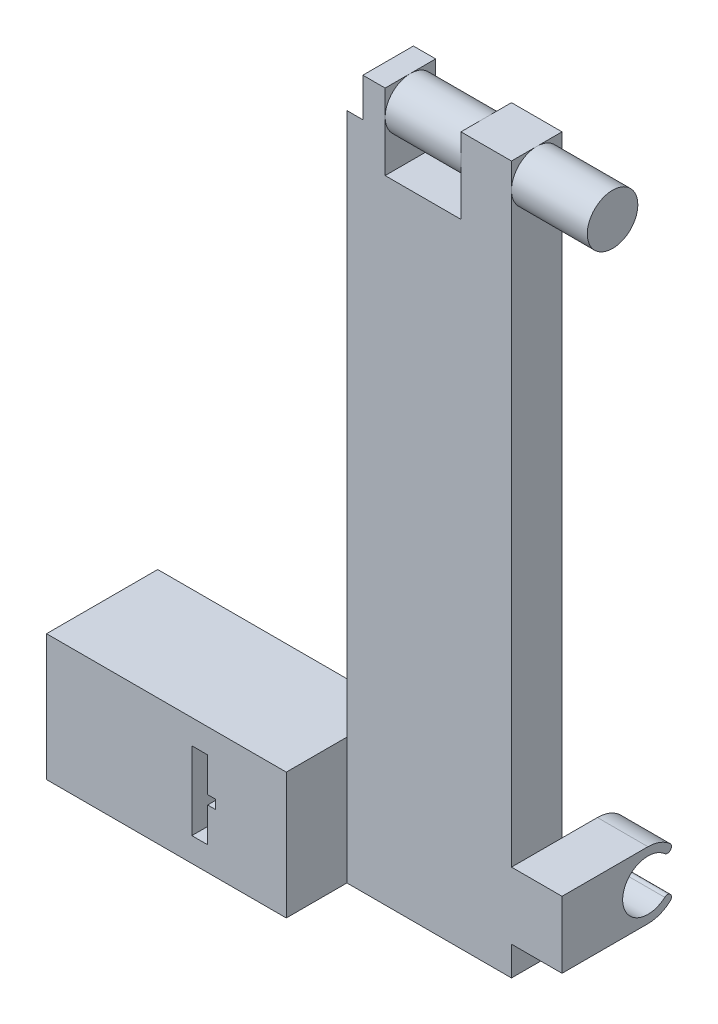
from build123d import *

# Parameters (mm, degrees)
SKETCH1_W           = 12.7
SKETCH1_H           = 12.7
BOSS_EXTRUDE1_DEPTH = 177.8
SKETCH2_R           = 6.35
BOSS_EXTRUDE2_DEPTH = 25.4
SKETCH3_W           = 12.7
SKETCH3_H           = 158.75
BOSS_EXTRUDE3_DEPTH = 28.652
BOSS_EXTRUDE4_START = 19.05
SKETCH4_W           = 12.7
SKETCH4_H           = 19.05
BOSS_EXTRUDE4_DEPTH = 9.602
CUT_EXTRUDE1_START  = -4
SKETCH5_R           = 1.274448637
CUT_EXTRUDE1_DEPTH  = 4
CUT_EXTRUDE2_START  = -6.35
SKETCH5_2_R         = 1.274448637
CUT_EXTRUDE2_DEPTH  = 6.35
SKETCH8_W           = 9.448
SKETCH8_H           = 31.75
SKETCH8_W_2         = 50.8
BOSS_EXTRUDE5_DEPTH = 12.7
SKETCH8_3_W         = 9.448
SKETCH8_3_H         = 31.75
SKETCH8_3_W_2       = 50.8
BOSS_EXTRUDE6_DEPTH = 15.24
SKETCH9_W           = 41.402
SKETCH9_H           = 20.066
CUT_EXTRUDE3_DEPTH  = 21.082
SKETCH7_W           = 12.7
SKETCH7_H           = 16.764
BOSS_EXTRUDE7_DEPTH = 12.7
BOSS_EXTRUDE8_START = -38.1
BOSS_EXTRUDE8_DEPTH = 12.7
SKETCH10_W          = 3.962
SKETCH10_H          = 19.562
SKETCH10_W_2        = 3.2
SKETCH10_H_2        = 18.8
SKETCH10_W_3        = 2.372565257
SKETCH10_H_3        = 2.262
CUT_EXTRUDE4_DEPTH  = 207.185481547


with BuildPart() as part:
    # Sketch1 → Boss-Extrude1 (new body)
    with BuildSketch(Plane(origin=(0, 0, 0), x_dir=(1, 0, 0), z_dir=(0, 1, 0))):
        Rectangle(SKETCH1_W, SKETCH1_H)
    extrude(amount=-BOSS_EXTRUDE1_DEPTH)

    # Sketch2 → Boss-Extrude2 (add, symmetric)
    with BuildSketch(Plane(origin=(0, 0, 0), x_dir=(0, 0, -1), z_dir=(1, 0, 0))):
        with Locations((0, -6.35)):
            Circle(SKETCH2_R)
    extrude(amount=BOSS_EXTRUDE2_DEPTH, both=True)

    # Sketch3 → Boss-Extrude3 (add)
    with BuildSketch(Plane.ZY.offset(6.35)):
        with Locations((0, -98.425)):
            Rectangle(SKETCH3_W, SKETCH3_H)
    extrude(amount=BOSS_EXTRUDE3_DEPTH)

    # Sketch4 → Boss-Extrude4 (add)
    with BuildSketch(Plane.ZY.offset(6.35).offset(BOSS_EXTRUDE4_START)):
        with Locations((0, -9.525)):
            Rectangle(SKETCH4_W, SKETCH4_H)
    extrude(amount=BOSS_EXTRUDE4_DEPTH)

    # Sketch5 → Cut-Extrude1 (cut)
    with BuildSketch(Plane.ZY.offset(35.002).offset(CUT_EXTRUDE1_START)):
        with BuildLine():
            Line((-3.833, -30.756), (-3.833, -16.606))
            ThreePointArc((-3.833, -16.606), (-4.34616702, -13.44372234), (-5.833, -10.606))
            ThreePointArc((-5.833, -10.606), (-6.104434225, -10.218346078), (-6.35, -9.81380986))
            Line((-6.35, -9.81380986), (-6.35, 0))
            Line((-6.35, 0), (-3.697009279, 0))
            Line((-3.697009279, 0), (3.631009279, 0))
            Line((3.631009279, 0), (6.35, 0))
            Line((6.35, 0), (6.35, -9.693995201))
            ThreePointArc((6.35, -9.693995201), (6.075544052, -10.160893028), (5.767, -10.606))
            ThreePointArc((5.767, -10.606), (4.280167019, -13.44372234), (3.767, -16.606))
            Line((3.767, -16.606), (3.767, -30.756))
            ThreePointArc((3.767, -30.756), (-0.033, -34.556), (-3.833, -30.756))
        make_face()
        with Locations(Location((-0.033, -26.756, 0), (0, 0, 270))):
            Circle(SKETCH5_R, mode=Mode.SUBTRACT)
        with Locations(Location((-0.033, -30.756, 0), (0, 0, 270))):
            Circle(SKETCH5_R, mode=Mode.SUBTRACT)
    extrude(amount=CUT_EXTRUDE1_DEPTH, mode=Mode.SUBTRACT)

    # Sketch5<2> → Cut-Extrude2 (cut)
    with BuildSketch(Plane.ZY.offset(35.002).offset(CUT_EXTRUDE2_START)):
        with Locations(Location((-0.033, -26.756, 0), (0, 0, 270))):
            Circle(SKETCH5_2_R)
        with Locations(Location((-0.033, -30.756, 0), (0, 0, 270))):
            Circle(SKETCH5_2_R)
    extrude(amount=CUT_EXTRUDE2_DEPTH, mode=Mode.SUBTRACT)

    # Sketch8 → Boss-Extrude5 (add)
    with BuildSketch(Plane.XY.offset(6.35)):
        with Locations((-39.726, -161.925)):
            Rectangle(SKETCH8_W, SKETCH8_H)
        with Locations((-69.85, -161.925)):
            Rectangle(SKETCH8_W_2, SKETCH8_H)
    extrude(amount=-BOSS_EXTRUDE5_DEPTH)

    # Sketch8<3> → Boss-Extrude6 (add)
    with BuildSketch(Plane.XY.offset(6.35)):
        with Locations((-39.726, -161.925)):
            Rectangle(SKETCH8_3_W, SKETCH8_3_H)
        with Locations((-69.85, -161.925)):
            Rectangle(SKETCH8_3_W_2, SKETCH8_3_H)
    extrude(amount=BOSS_EXTRUDE6_DEPTH)

    # Sketch9 → Cut-Extrude3 (cut)
    with BuildSketch(Plane(origin=(0, 0, -6.35), x_dir=(-1, 0, 0), z_dir=(0, 0, -1))):
        with Locations((65.151, -161.925)):
            Rectangle(SKETCH9_W, SKETCH9_H)
    extrude(amount=-CUT_EXTRUDE3_DEPTH, mode=Mode.SUBTRACT)

    # Sketch7 → Boss-Extrude7 (add)
    with BuildSketch(Plane(origin=(6.35, 0, 0), x_dir=(0, 0, -1), z_dir=(1, 0, 0))):
        with BuildLine():
            Line((6.35, -153.67), (6.35, -170.434))
            Line((6.35, -170.434), (15.24, -170.434))
            ThreePointArc((15.24, -170.434), (18.221863859, -169.885671676), (20.813596386, -168.312427088))
            ThreePointArc((20.813596386, -168.312427088), (20.896848593, -166.878), (19.462421505, -166.794747794))
            ThreePointArc((19.462421505, -166.794747794), (8.89, -162.052), (19.462421505, -157.309252206))
            Line((19.462421505, -157.309252206), (20.813596386, -155.791572912))
            ThreePointArc((20.813596386, -155.791572912), (18.221863859, -154.218328324), (15.24, -153.67))
            Line((15.24, -153.67), (6.35, -153.67))
        make_face()
        with Locations((0, -162.052)):
            Rectangle(SKETCH7_W, SKETCH7_H)
        with BuildLine():
            ThreePointArc((19.462421505, -157.309252206), (20.896848593, -157.226), (20.813596386, -155.791572912))
            Line((20.813596386, -155.791572912), (19.462421505, -157.309252206))
        make_face()
    extrude(amount=BOSS_EXTRUDE7_DEPTH)

    # Sketch7<4> → Boss-Extrude8 (add)
    with BuildSketch(Plane(origin=(6.35, 0, 0), x_dir=(0, 0, -1), z_dir=(1, 0, 0)).offset(BOSS_EXTRUDE8_START)):
        with BuildLine():
            Line((6.35, -153.67), (6.35, -170.434))
            Line((6.35, -170.434), (15.24, -170.434))
            ThreePointArc((15.24, -170.434), (18.221863859, -169.885671676), (20.813596386, -168.312427088))
            ThreePointArc((20.813596386, -168.312427088), (20.896848593, -166.878), (19.462421505, -166.794747794))
            ThreePointArc((19.462421505, -166.794747794), (8.89, -162.052), (19.462421505, -157.309252206))
            ThreePointArc((19.462421505, -157.309252206), (20.896848593, -157.226), (20.813596386, -155.791572912))
            ThreePointArc((20.813596386, -155.791572912), (18.221863859, -154.218328324), (15.24, -153.67))
            Line((15.24, -153.67), (6.35, -153.67))
        make_face()
    extrude(amount=BOSS_EXTRUDE8_DEPTH)

    # Sketch10 → Cut-Extrude4 (cut, through all)
    # profile 1 of 2: a face of its own
    with BuildSketch(Plane.XY.offset(21.59)):
        with Locations((-56.752, -161.958)):
            Rectangle(SKETCH10_W, SKETCH10_H)
        with Locations((-56.752, -161.958)):
            Rectangle(SKETCH10_W_2, SKETCH10_H_2, mode=Mode.SUBTRACT)
    # profile 2 of 2: a face of its own
    with BuildSketch(Plane.XY.offset(21.59)):
        with Locations((-53.965717372, -161.958)):
            Rectangle(SKETCH10_W_3, SKETCH10_H_3)
    extrude(amount=-CUT_EXTRUDE4_DEPTH, mode=Mode.SUBTRACT)


with BuildPart() as cut_extrude4_kept_piece:
    # of the separate pieces the step leaves, the one the design keeps (cut_extrude4_pieces_kept)
    add(part.part.solids().sort_by_distance((-6.35, 0, 6.35))[0])


solid = cut_extrude4_kept_piece.part
